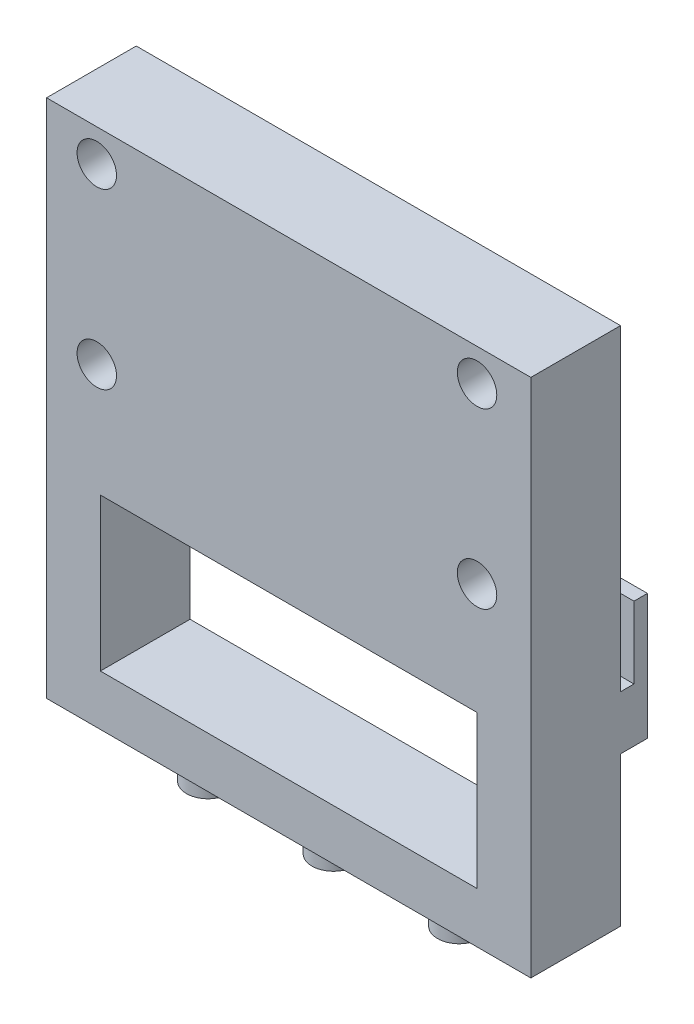
from build123d import *

# Parameters (mm, degrees)
SKETCH1_W           = 27
SKETCH1_H           = 29
BOSS_EXTRUDE1_DEPTH = 5
SKETCH3_R           = 1.1
CUT_EXTRUDE2_DEPTH  = 10
SKETCH4_W           = 21
SKETCH4_H           = 8.5
CUT_EXTRUDE3_DEPTH  = 10
SKETCH2_R           = 1.2
BOSS_EXTRUDE2_DEPTH = 2
SKETCH7_W           = 3
SKETCH7_H           = 3
BOSS_EXTRUDE5_DEPTH = 1.5
SKETCH8_W           = 27
SKETCH8_H           = 0.75
BOSS_EXTRUDE6_DEPTH = 4


with BuildPart() as part:
    # Sketch1 → Boss-Extrude1 (new body)
    with BuildSketch(Plane.XY):
        Rectangle(SKETCH1_W, SKETCH1_H)
    extrude(amount=BOSS_EXTRUDE1_DEPTH)

    # Sketch3 → Cut-Extrude2 (cut)
    with BuildSketch(Plane.XY.offset(5)):
        with Locations((-10.7, 12.7)):
            Circle(SKETCH3_R)
        with Locations((10.5, 12.7)):
            Circle(SKETCH3_R)
        with Locations((-10.7, 3.025)):
            Circle(SKETCH3_R)
        with Locations((10.5, 3.025)):
            Circle(SKETCH3_R)
    extrude(amount=-CUT_EXTRUDE2_DEPTH, mode=Mode.SUBTRACT)

    # Sketch4 → Cut-Extrude3 (cut)
    with BuildSketch(Plane.XY.offset(5)):
        with Locations((0, -7.429078055)):
            Rectangle(SKETCH4_W, SKETCH4_H)
    extrude(amount=-CUT_EXTRUDE3_DEPTH, mode=Mode.SUBTRACT)

    # Sketch2 → Boss-Extrude2 (add)
    with BuildSketch(Plane.XZ.offset(14.5)):
        with Locations(Location((-7, 2.5, 0), (0, 0, 90))):
            Circle(SKETCH2_R)
        with Locations(Location((0, 2.5, 0), (0, 0, 90))):
            Circle(SKETCH2_R)
        with Locations(Location((7, 2.5, 0), (0, 0, 90))):
            Circle(SKETCH2_R)
    extrude(amount=BOSS_EXTRUDE2_DEPTH)

    # Sketch7 → Boss-Extrude5 (add)
    with BuildSketch(Plane(origin=(0, 0, 0), x_dir=(-1, 0, 0), z_dir=(0, 0, -1))):
        with Locations((-12, -4.679078055)):
            Rectangle(SKETCH7_W, SKETCH7_H)
        with Locations((12, -4.679078055)):
            Rectangle(SKETCH7_W, SKETCH7_H)
    extrude(amount=BOSS_EXTRUDE5_DEPTH)

    # Sketch8 → Boss-Extrude6 (add)
    with BuildSketch(Plane(origin=(0, -3.179078055, 0), x_dir=(1, 0, 0), z_dir=(0, 1, 0))):
        with Locations((0, 1.125)):
            Rectangle(SKETCH8_W, SKETCH8_H)
    extrude(amount=BOSS_EXTRUDE6_DEPTH)


solid = part.part
